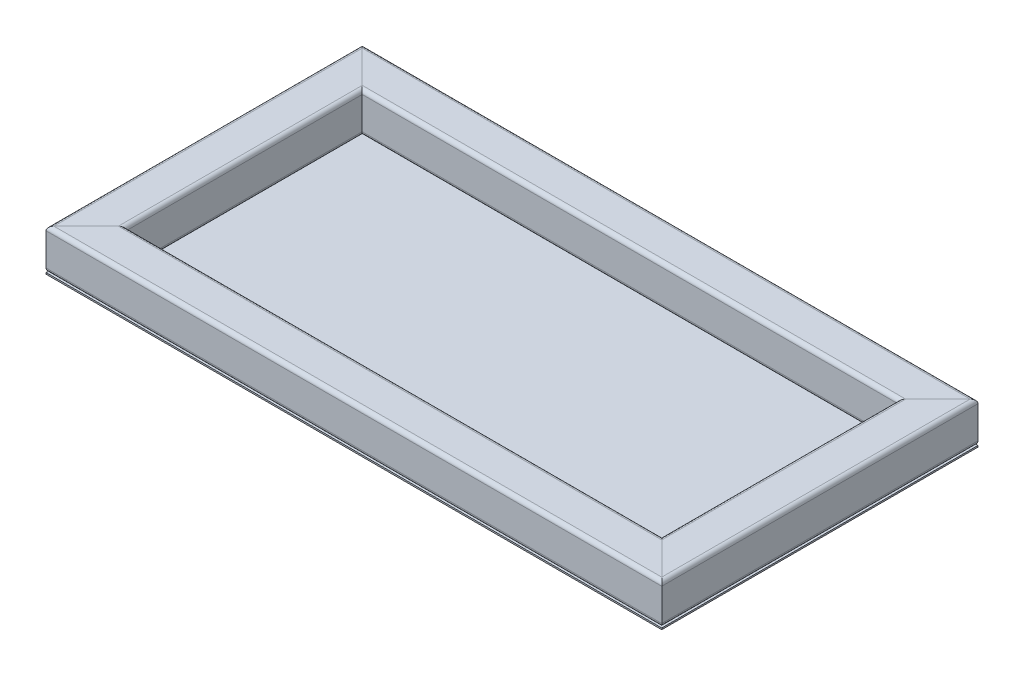
from build123d import *

# Parameters (mm, degrees)
TUBO_CUADRADO_2_X_2_X_0_25_1_DEPTH      = 473.442048969
TUBO_CUADRADO_2_X_2_X_0_25_1_DEPTH_BACK = 72.842048969
TUBO_CUADRADO_2_X_2_X_0_25_1_2_DEPTH    = 925.684097937
TUBO_CUADRADO_2_X_2_X_0_25_1_3_DEPTH    = 546.284097937
TUBO_CUADRADO_2_X_2_X_0_25_1_4_DEPTH    = 925.684097937
CROQUIS3_W                              = 780
CROQUIS3_H                              = 400.6
SALIENTE_EXTRUIR1_DEPTH                 = 1.9


with BuildPart() as part:
    # Sketch1 → Tubo cuadrado 2 X 2 X 0.25(1) (new, two sides: drawn at the far end of the back side and taken through both)
    with BuildSketch(Plane(origin=(-364.6, 25.4, -200.3), x_dir=(1, 0, 0), z_dir=(0, 0, 1)).offset(-TUBO_CUADRADO_2_X_2_X_0_25_1_DEPTH_BACK)):
        with BuildLine():
            Line((-20.4, -25.4), (20.4, -25.4))
            ThreePointArc((20.4, -25.4), (23.935533906, -23.935533906), (25.4, -20.4))
            Line((25.4, -20.4), (25.4, 20.4))
            ThreePointArc((25.4, 20.4), (23.935533906, 23.935533906), (20.4, 25.4))
            Line((20.4, 25.4), (-20.4, 25.4))
            ThreePointArc((-20.4, 25.4), (-23.935533906, 23.935533906), (-25.4, 20.4))
            Line((-25.4, 20.4), (-25.4, -20.4))
            ThreePointArc((-25.4, -20.4), (-23.935533906, -23.935533906), (-20.4, -25.4))
        make_face()
        with BuildLine():
            Line((-20.4, -23.4), (20.4, -23.4))
            ThreePointArc((20.4, -23.4), (22.521320344, -22.521320344), (23.4, -20.4))
            Line((23.4, -20.4), (23.4, 20.4))
            ThreePointArc((23.4, 20.4), (22.521320344, 22.521320344), (20.4, 23.4))
            Line((20.4, 23.4), (-20.4, 23.4))
            ThreePointArc((-20.4, 23.4), (-22.521320344, 22.521320344), (-23.4, 20.4))
            Line((-23.4, 20.4), (-23.4, -20.4))
            ThreePointArc((-23.4, -20.4), (-22.521320344, -22.521320344), (-20.4, -23.4))
        make_face(mode=Mode.SUBTRACT)
    extrude(amount=TUBO_CUADRADO_2_X_2_X_0_25_1_DEPTH + TUBO_CUADRADO_2_X_2_X_0_25_1_DEPTH_BACK)

    # Tubo cuadrado 2 X 2 X 0.25(1) mitre 1
    split(bisect_by=Plane(origin=(-390, 0, -200.3), x_dir=(0, -1, 0), z_dir=(-0.707106781, 0, 0.707106781)), keep=Keep.TOP)

    # Tubo cuadrado 2 X 2 X 0.25(1) mitre 2
    split(bisect_by=Plane(origin=(-390, 0, 200.3), x_dir=(0, -1, 0), z_dir=(-0.707106781, 0, -0.707106781)), keep=Keep.TOP)


with BuildPart() as body_2:
    # Sketch1 on segment 2 (carried to segment 2) → Tubo cuadrado 2 X 2 X 0.25_1 2 (new body)
    with BuildSketch(Plane(origin=(-462.842048969, 25.4, 174.9), x_dir=(0, 0, -1), z_dir=(1, 0, 0))):
        with BuildLine():
            Line((-20.4, -25.4), (20.4, -25.4))
            ThreePointArc((20.4, -25.4), (23.935533906, -23.935533906), (25.4, -20.4))
            Line((25.4, -20.4), (25.4, 20.4))
            ThreePointArc((25.4, 20.4), (23.935533906, 23.935533906), (20.4, 25.4))
            Line((20.4, 25.4), (-20.4, 25.4))
            ThreePointArc((-20.4, 25.4), (-23.935533906, 23.935533906), (-25.4, 20.4))
            Line((-25.4, 20.4), (-25.4, -20.4))
            ThreePointArc((-25.4, -20.4), (-23.935533906, -23.935533906), (-20.4, -25.4))
        make_face()
        with BuildLine():
            Line((-20.4, -23.4), (20.4, -23.4))
            ThreePointArc((20.4, -23.4), (22.521320344, -22.521320344), (23.4, -20.4))
            Line((23.4, -20.4), (23.4, 20.4))
            ThreePointArc((23.4, 20.4), (22.521320344, 22.521320344), (20.4, 23.4))
            Line((20.4, 23.4), (-20.4, 23.4))
            ThreePointArc((-20.4, 23.4), (-22.521320344, 22.521320344), (-23.4, 20.4))
            Line((-23.4, 20.4), (-23.4, -20.4))
            ThreePointArc((-23.4, -20.4), (-22.521320344, -22.521320344), (-20.4, -23.4))
        make_face(mode=Mode.SUBTRACT)
    extrude(amount=TUBO_CUADRADO_2_X_2_X_0_25_1_2_DEPTH)

    # Tubo cuadrado 2 X 2 X 0.25_1 2 mitre 1
    split(bisect_by=Plane(origin=(-390, 0, 200.3), x_dir=(0, 1, 0), z_dir=(0.707106781, 0, 0.707106781)), keep=Keep.TOP)

    # Tubo cuadrado 2 X 2 X 0.25_1 2 mitre 2
    split(bisect_by=Plane(origin=(390, 0, 200.3), x_dir=(0, -1, 0), z_dir=(-0.707106781, 0, 0.707106781)), keep=Keep.TOP)


with BuildPart() as body_3:
    # Sketch1 on segment 3 (carried to segment 3) → Tubo cuadrado 2 X 2 X 0.25_1 3 (new body)
    with BuildSketch(Plane(origin=(364.6, 25.4, 273.142048969), x_dir=(-1, 0, 0), z_dir=(0, 0, -1))):
        with BuildLine():
            Line((-20.4, -25.4), (20.4, -25.4))
            ThreePointArc((20.4, -25.4), (23.935533906, -23.935533906), (25.4, -20.4))
            Line((25.4, -20.4), (25.4, 20.4))
            ThreePointArc((25.4, 20.4), (23.935533906, 23.935533906), (20.4, 25.4))
            Line((20.4, 25.4), (-20.4, 25.4))
            ThreePointArc((-20.4, 25.4), (-23.935533906, 23.935533906), (-25.4, 20.4))
            Line((-25.4, 20.4), (-25.4, -20.4))
            ThreePointArc((-25.4, -20.4), (-23.935533906, -23.935533906), (-20.4, -25.4))
        make_face()
        with BuildLine():
            Line((-20.4, -23.4), (20.4, -23.4))
            ThreePointArc((20.4, -23.4), (22.521320344, -22.521320344), (23.4, -20.4))
            Line((23.4, -20.4), (23.4, 20.4))
            ThreePointArc((23.4, 20.4), (22.521320344, 22.521320344), (20.4, 23.4))
            Line((20.4, 23.4), (-20.4, 23.4))
            ThreePointArc((-20.4, 23.4), (-22.521320344, 22.521320344), (-23.4, 20.4))
            Line((-23.4, 20.4), (-23.4, -20.4))
            ThreePointArc((-23.4, -20.4), (-22.521320344, -22.521320344), (-20.4, -23.4))
        make_face(mode=Mode.SUBTRACT)
    extrude(amount=TUBO_CUADRADO_2_X_2_X_0_25_1_3_DEPTH)

    # Tubo cuadrado 2 X 2 X 0.25_1 3 mitre 1
    split(bisect_by=Plane(origin=(390, 0, -200.3), x_dir=(0, 1, 0), z_dir=(0.707106781, 0, 0.707106781)), keep=Keep.TOP)

    # Tubo cuadrado 2 X 2 X 0.25_1 3 mitre 2
    split(bisect_by=Plane(origin=(390, 0, 200.3), x_dir=(0, 1, 0), z_dir=(0.707106781, 0, -0.707106781)), keep=Keep.TOP)


with BuildPart() as body_4:
    # Sketch1 on segment 4 (carried to segment 4) → Tubo cuadrado 2 X 2 X 0.25_1 4 (new body)
    with BuildSketch(Plane(origin=(462.842048969, 25.4, -174.9), x_dir=(0, 0, 1), z_dir=(-1, 0, 0))):
        with BuildLine():
            Line((-20.4, -25.4), (20.4, -25.4))
            ThreePointArc((20.4, -25.4), (23.935533906, -23.935533906), (25.4, -20.4))
            Line((25.4, -20.4), (25.4, 20.4))
            ThreePointArc((25.4, 20.4), (23.935533906, 23.935533906), (20.4, 25.4))
            Line((20.4, 25.4), (-20.4, 25.4))
            ThreePointArc((-20.4, 25.4), (-23.935533906, 23.935533906), (-25.4, 20.4))
            Line((-25.4, 20.4), (-25.4, -20.4))
            ThreePointArc((-25.4, -20.4), (-23.935533906, -23.935533906), (-20.4, -25.4))
        make_face()
        with BuildLine():
            Line((-20.4, -23.4), (20.4, -23.4))
            ThreePointArc((20.4, -23.4), (22.521320344, -22.521320344), (23.4, -20.4))
            Line((23.4, -20.4), (23.4, 20.4))
            ThreePointArc((23.4, 20.4), (22.521320344, 22.521320344), (20.4, 23.4))
            Line((20.4, 23.4), (-20.4, 23.4))
            ThreePointArc((-20.4, 23.4), (-22.521320344, 22.521320344), (-23.4, 20.4))
            Line((-23.4, 20.4), (-23.4, -20.4))
            ThreePointArc((-23.4, -20.4), (-22.521320344, -22.521320344), (-20.4, -23.4))
        make_face(mode=Mode.SUBTRACT)
    extrude(amount=TUBO_CUADRADO_2_X_2_X_0_25_1_4_DEPTH)

    # Tubo cuadrado 2 X 2 X 0.25_1 4 mitre 1
    split(bisect_by=Plane(origin=(-390, 0, -200.3), x_dir=(0, 1, 0), z_dir=(0.707106781, 0, -0.707106781)), keep=Keep.TOP)

    # Tubo cuadrado 2 X 2 X 0.25_1 4 mitre 2
    split(bisect_by=Plane(origin=(390, 0, -200.3), x_dir=(0, -1, 0), z_dir=(-0.707106781, 0, -0.707106781)), keep=Keep.TOP)


with BuildPart() as body_5:
    # Croquis3 → Saliente-Extruir1 (new body)
    with BuildSketch(Plane.XZ):
        Rectangle(CROQUIS3_W, CROQUIS3_H)
    extrude(amount=SALIENTE_EXTRUIR1_DEPTH)


solid = Compound([part.part, body_2.part, body_3.part, body_4.part, body_5.part])
